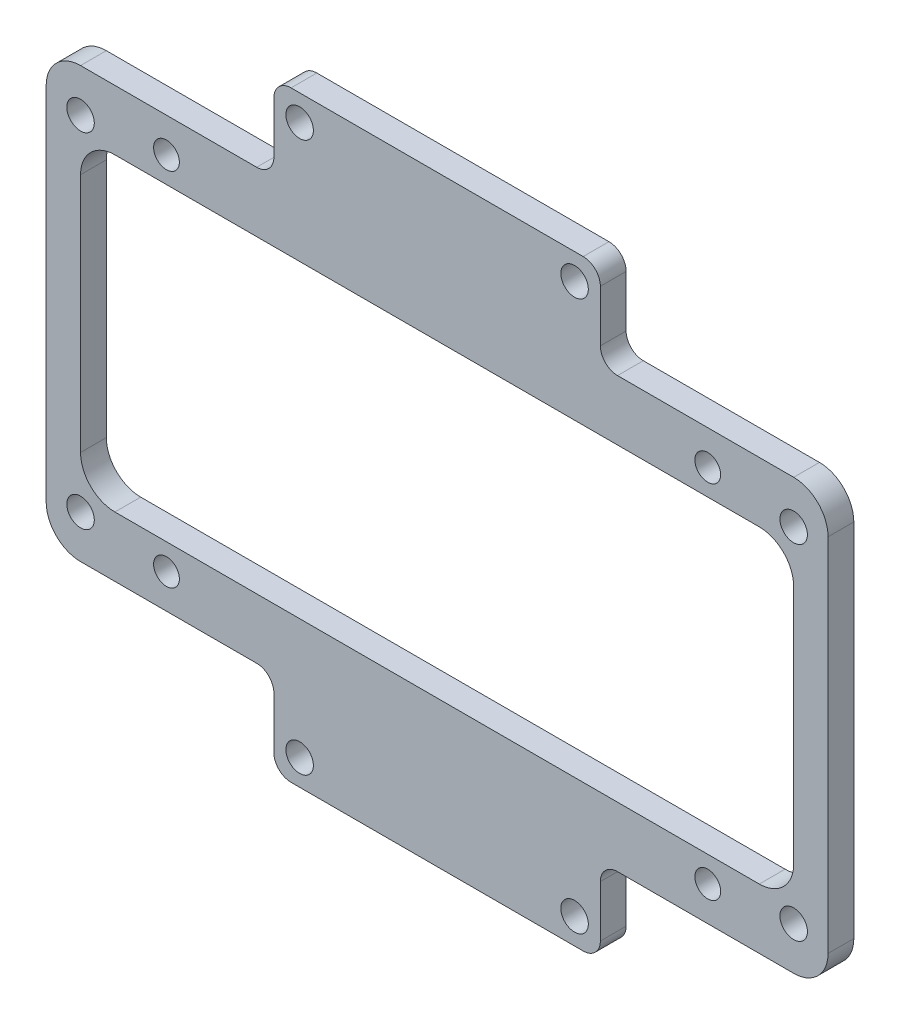
from build123d import *

# Parameters (mm, degrees)
SKETCH_1_W          = 91
SKETCH_1_H          = 50
SKETCH_1_W_2        = 83
SKETCH_1_H_2        = 36
EXTRUDE_1_DEPTH     = 3
SKETCH_2_R          = 1.5
CUT_EXTRUDE_1_DEPTH = 3
SKETCH_3_R          = 1.6
CUT_EXTRUDE_2_DEPTH = 3
FILLET_1_R          = 4
SKETCH_4_W          = 30
SKETCH_4_H          = 35
EXTRUDE_2_DEPTH     = 3
SKETCH_5_R          = 1.25
CUT_EXTRUDE_3_DEPTH = 10
FILLET_2_R          = 3
SKETCH_6_W          = 18
SKETCH_6_H          = 27
CUT_EXTRUDE_4_DEPTH = 10
FILLET_3_R          = 2
SKETCH_7_W          = 38
SKETCH_7_H          = 10
SKETCH_7_R          = 1.6
EXTRUDE_3_DEPTH     = 3
FILLET_4_R          = 2
FILLET_5_R          = 2
SKETCH_8_W          = 30
SKETCH_8_H          = 41
CUT_EXTRUDE_5_DEPTH = 10


with BuildPart() as part:
    # 草图1 → 凸台-拉伸1 (new body)
    with BuildSketch(Plane.XY):
        Rectangle(SKETCH_1_W, SKETCH_1_H)
        Rectangle(SKETCH_1_W_2, SKETCH_1_H_2, mode=Mode.SUBTRACT)
    extrude(amount=EXTRUDE_1_DEPTH)

    # 草图2 → 切除-拉伸1 (cut)
    with BuildSketch(Plane.XY.offset(3)):
        with Locations((31.5, 21)):
            Circle(SKETCH_2_R)
        with Locations((31.5, -21)):
            Circle(SKETCH_2_R)
        with Locations((-31.5, -21)):
            Circle(SKETCH_2_R)
        with Locations((-31.5, 21)):
            Circle(SKETCH_2_R)
    extrude(amount=-CUT_EXTRUDE_1_DEPTH, mode=Mode.SUBTRACT)

    # 草图3 → 切除-拉伸2 (cut)
    with BuildSketch(Plane.XY.offset(3)):
        with Locations((41.5, 20)):
            Circle(SKETCH_3_R)
        with Locations((41.5, -20)):
            Circle(SKETCH_3_R)
        with Locations((-41.5, -20)):
            Circle(SKETCH_3_R)
        with Locations((-41.5, 20)):
            Circle(SKETCH_3_R)
    extrude(amount=-CUT_EXTRUDE_2_DEPTH, mode=Mode.SUBTRACT)

    # 圆角1
    fillet_1_edges = [part.edges().sort_by_distance(p)[0] for p in [
        (41.5, -18, 1.5),
        (41.5, 18, 1.5),
        (-41.5, 18, 1.5),
        (-41.5, -18, 1.5),
        (45.5, -25, 1.5),
        (-45.5, -25, 1.5),
        (-45.5, 25, 1.5),
        (45.5, 25, 1.5),
    ]]
    fillet(fillet_1_edges, radius=FILLET_1_R)

    # 草图4 → 凸台-拉伸2 (add)
    with BuildSketch(Plane(origin=(0, 0, 0), x_dir=(-1, 0, 0), z_dir=(0, 0, -1))):
        with Locations((-60.5, 0)):
            Rectangle(SKETCH_4_W, SKETCH_4_H)
    extrude(amount=-EXTRUDE_2_DEPTH)

    # 草图5 → 切除-拉伸3 (cut)
    with BuildSketch(Plane(origin=(0, 0, 0), x_dir=(-1, 0, 0), z_dir=(0, 0, -1))):
        with Locations((-70.5, -12)):
            Circle(SKETCH_5_R)
        with Locations((-70.5, 12)):
            Circle(SKETCH_5_R)
    extrude(amount=-CUT_EXTRUDE_3_DEPTH, mode=Mode.SUBTRACT)

    # 圆角2
    fillet_2_edges = [part.edges().sort_by_distance(p)[0] for p in [
        (45.5, 17.5, 1.5),
        (45.5, -17.5, 1.5),
        (75.5, -17.5, 1.5),
        (75.5, 17.5, 1.5),
    ]]
    fillet(fillet_2_edges, radius=FILLET_2_R)

    # 草图6 → 切除-拉伸4 (cut)
    with BuildSketch(Plane(origin=(0, 0, 0), x_dir=(-1, 0, 0), z_dir=(0, 0, -1))):
        with Locations((-57.5, 0)):
            Rectangle(SKETCH_6_W, SKETCH_6_H)
    extrude(amount=-CUT_EXTRUDE_4_DEPTH, mode=Mode.SUBTRACT)

    # 圆角3
    fillet_3_edges = [part.edges().sort_by_distance(p)[0] for p in [
        (66.5, -13.5, 1.5),
        (66.5, 13.5, 1.5),
        (48.5, 13.5, 1.5),
        (48.5, -13.5, 1.5),
    ]]
    fillet(fillet_3_edges, radius=FILLET_3_R)

    # 草图7 → 凸台-拉伸3 (add)
    # profile 1 of 2: a face of its own
    with BuildSketch(Plane(origin=(0, 0, 0), x_dir=(-1, 0, 0), z_dir=(0, 0, -1))):
        with Locations((0, 30)):
            Rectangle(SKETCH_7_W, SKETCH_7_H)
        with Locations((-16, 32)):
            Circle(SKETCH_7_R, mode=Mode.SUBTRACT)
        with Locations((16, 32)):
            Circle(SKETCH_7_R, mode=Mode.SUBTRACT)
    # profile 2 of 2: a face of its own
    with BuildSketch(Plane(origin=(0, 0, 0), x_dir=(-1, 0, 0), z_dir=(0, 0, -1))):
        with Locations((0, -30)):
            Rectangle(SKETCH_7_W, SKETCH_7_H)
        with Locations((16, -32)):
            Circle(SKETCH_7_R, mode=Mode.SUBTRACT)
        with Locations((-16, -32)):
            Circle(SKETCH_7_R, mode=Mode.SUBTRACT)
    extrude(amount=-EXTRUDE_3_DEPTH)

    # 圆角4
    fillet_4_edges = [part.edges().sort_by_distance(p)[0] for p in [
        (19, 35, 1.5),
        (-19, 35, 1.5),
        (-19, -35, 1.5),
        (19, -35, 1.5),
    ]]
    fillet(fillet_4_edges, radius=FILLET_4_R)

    # 圆角5
    fillet_5_edges = [part.edges().sort_by_distance(p)[0] for p in [
        (19, 25, 1.5),
        (-19, 25, 1.5),
        (-19, -25, 1.5),
        (19, -25, 1.5),
    ]]
    fillet(fillet_5_edges, radius=FILLET_5_R)

    # 草图8 → 切除-拉伸5 (cut)
    with BuildSketch(Plane.XY.offset(3)):
        with Locations((60.5, 0)):
            Rectangle(SKETCH_8_W, SKETCH_8_H)
    extrude(amount=-CUT_EXTRUDE_5_DEPTH, mode=Mode.SUBTRACT)


solid = part.part
